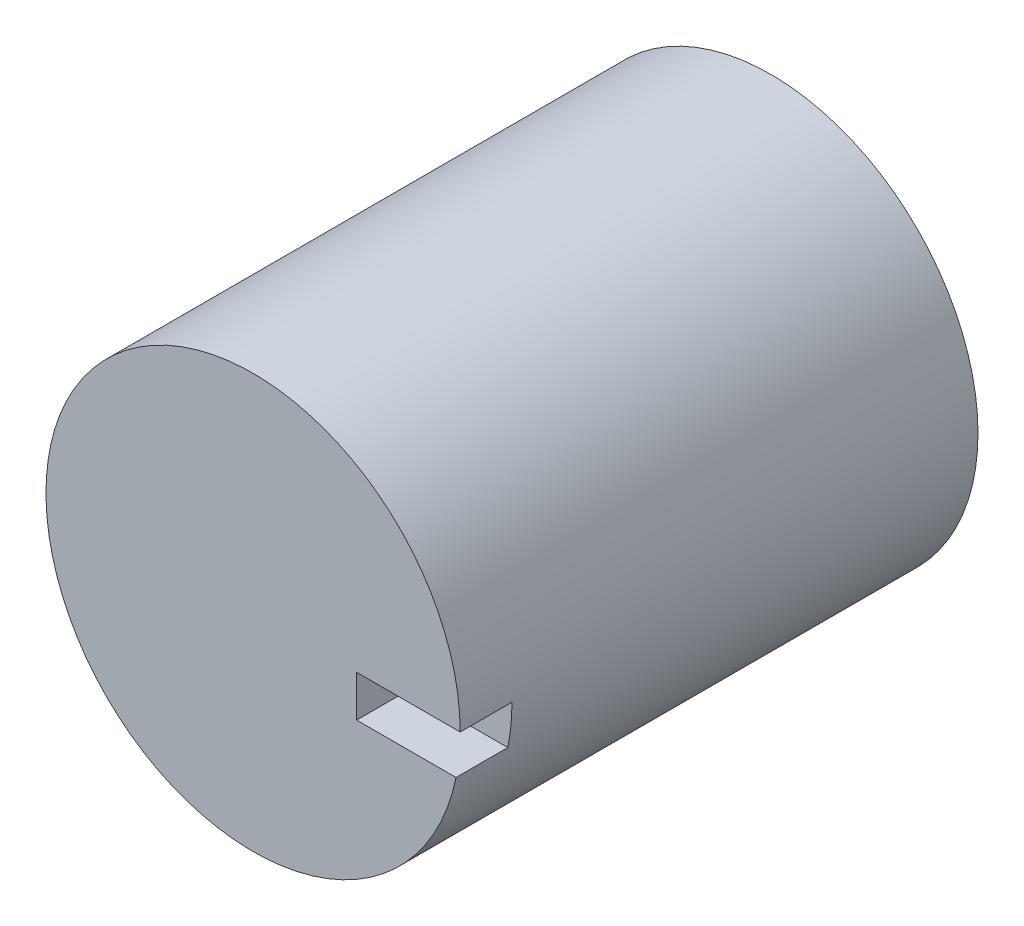
from build123d import *

# Parameters (mm, degrees)
SKETCH_1_R          = 20
EXTRUDE_1_DEPTH     = 50
SKETCH_2_W          = 30
SKETCH_2_H          = 10
CUT_EXTRUDE_1_DEPTH = 4


with BuildPart() as part:
    # 草图1 → 凸台-拉伸1 (new body)
    with BuildSketch(Plane.XY):
        Circle(SKETCH_1_R)
    extrude(amount=-EXTRUDE_1_DEPTH)

    # 草图2 → 切除-拉伸1 (cut)
    with BuildSketch(Plane(origin=(0, 0, 0), x_dir=(1, 0, 0), z_dir=(0, 1, 0))):
        with Locations((25, 0)):
            Rectangle(SKETCH_2_W, SKETCH_2_H)
    extrude(amount=-CUT_EXTRUDE_1_DEPTH, mode=Mode.SUBTRACT)


solid = part.part
